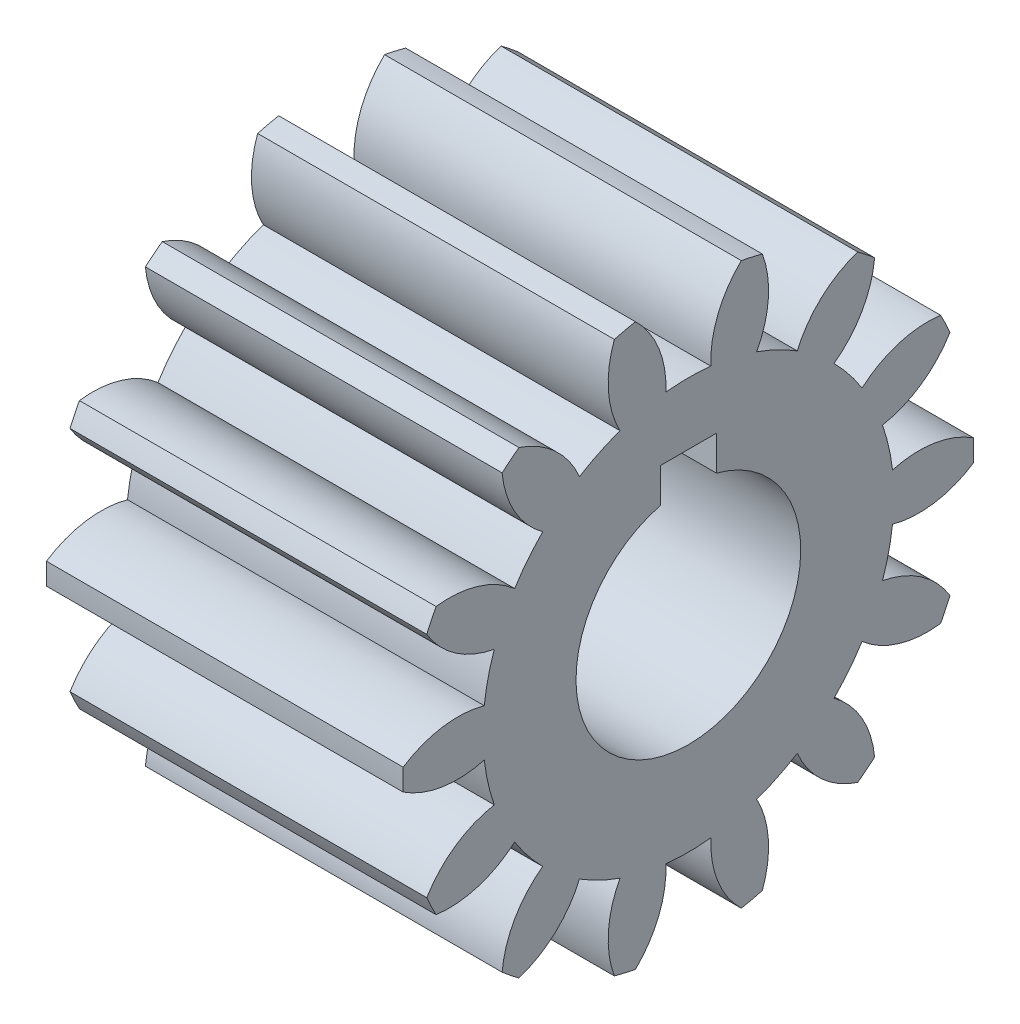
from build123d import *

# Parameters (mm, degrees)
BOSS_EXTRUDE1_DEPTH = 12.7


with BuildPart() as part:
    # Sketch1 → Boss-Extrude1 (new body)
    with BuildSketch(Plane(origin=(0, 0, 0), x_dir=(0, -1, 0), z_dir=(-1, 0, 0))):
        with BuildLine():
            ThreePointArc((-8.177440487, -6.029516323), (-7.943407862, -6.334656387), (-7.697995454, -6.630721377))
            ThreePointArc((-7.697995454, -6.630721377), (-6.273562142, -6.180849316), (-5.15957287, -5.185649317))
            ThreePointArc((-5.15957287, -5.185649317), (-4.560952599, -5.719253661), (-3.907521288, -6.184127135))
            ThreePointArc((-3.907521288, -6.184127135), (-4.629883612, -7.491639203), (-4.75151021, -8.98046495))
            ThreePointArc((-4.75151021, -8.98046495), (-4.408258789, -9.153843698), (-4.058692066, -9.314108584))
            ThreePointArc((-4.058692066, -9.314108584), (-2.970514168, -8.29074941), (-2.398645612, -6.910763363))
            ThreePointArc((-2.398645612, -6.910763363), (-1.627785136, -7.131792663), (-0.837362826, -7.267115971))
            ThreePointArc((-0.837362826, -7.267115971), (-0.920880567, -8.758564905), (-0.384485064, -10.152722356))
            ThreePointArc((-0.384485064, -10.152722356), (0, -10.16), (0.384485064, -10.152722356))
            ThreePointArc((0.384485064, -10.152722356), (0.920880567, -8.758564905), (0.837362826, -7.267115971))
            ThreePointArc((0.837362826, -7.267115971), (1.627785136, -7.131792663), (2.398645612, -6.910763363))
            ThreePointArc((2.398645612, -6.910763363), (2.970514168, -8.29074941), (4.058692066, -9.314108584))
            ThreePointArc((4.058692066, -9.314108584), (4.408258789, -9.153843698), (4.75151021, -8.98046495))
            ThreePointArc((4.75151021, -8.98046495), (4.629883612, -7.491639203), (3.907521288, -6.184127135))
            ThreePointArc((3.907521288, -6.184127135), (4.560952599, -5.719253661), (5.15957287, -5.185649317))
            ThreePointArc((5.15957287, -5.185649317), (6.273562142, -6.180849316), (7.697995454, -6.630721377))
            ThreePointArc((7.697995454, -6.630721377), (7.943407862, -6.334656387), (8.177440487, -6.029516323))
            ThreePointArc((8.177440487, -6.029516323), (7.421881426, -4.740902478), (6.203747236, -3.876296077))
            ThreePointArc((6.203747236, -3.876296077), (6.590767462, -3.173946328), (6.898583443, -2.433453825))
            ThreePointArc((6.898583443, -2.433453825), (8.334054192, -2.846756211), (9.812616434, -2.634038481))
            ThreePointArc((9.812616434, -2.634038481), (9.905267588, -2.260812689), (9.983728385, -1.884348041))
            ThreePointArc((9.983728385, -1.884348041), (8.7438846, -1.051171874), (7.271244959, -0.800717041))
            ThreePointArc((7.271244959, -0.800717041), (7.3152, 0), (7.271244959, 0.800717041))
            ThreePointArc((7.271244959, 0.800717041), (8.7438846, 1.051171874), (9.983728385, 1.884348041))
            ThreePointArc((9.983728385, 1.884348041), (9.905267588, 2.260812689), (9.812616434, 2.634038481))
            ThreePointArc((9.812616434, 2.634038481), (8.334054192, 2.846756211), (6.898583443, 2.433453825))
            ThreePointArc((6.898583443, 2.433453825), (6.590767462, 3.173946328), (6.203747236, 3.876296077))
            ThreePointArc((6.203747236, 3.876296077), (7.421881426, 4.740902478), (8.177440487, 6.029516323))
            ThreePointArc((8.177440487, 6.029516323), (7.943407862, 6.334656387), (7.697995454, 6.630721377))
            ThreePointArc((7.697995454, 6.630721377), (6.273562142, 6.180849316), (5.15957287, 5.185649317))
            ThreePointArc((5.15957287, 5.185649317), (4.560952599, 5.719253661), (3.907521288, 6.184127135))
            ThreePointArc((3.907521288, 6.184127135), (4.629883612, 7.491639203), (4.75151021, 8.98046495))
            ThreePointArc((4.75151021, 8.98046495), (4.408258789, 9.153843698), (4.058692066, 9.314108584))
            ThreePointArc((4.058692066, 9.314108584), (2.970514168, 8.29074941), (2.398645612, 6.910763363))
            ThreePointArc((2.398645612, 6.910763363), (1.627785136, 7.131792663), (0.837362826, 7.267115971))
            ThreePointArc((0.837362826, 7.267115971), (0.920880567, 8.758564905), (0.384485064, 10.152722356))
            ThreePointArc((0.384485064, 10.152722356), (0, 10.16), (-0.384485064, 10.152722356))
            ThreePointArc((-0.384485064, 10.152722356), (-0.920880567, 8.758564905), (-0.837362826, 7.267115971))
            ThreePointArc((-0.837362826, 7.267115971), (-1.627785136, 7.131792663), (-2.398645612, 6.910763363))
            ThreePointArc((-2.398645612, 6.910763363), (-2.970514168, 8.29074941), (-4.058692066, 9.314108584))
            ThreePointArc((-4.058692066, 9.314108584), (-4.408258789, 9.153843698), (-4.75151021, 8.98046495))
            ThreePointArc((-4.75151021, 8.98046495), (-4.629883612, 7.491639203), (-3.907521288, 6.184127135))
            ThreePointArc((-3.907521288, 6.184127135), (-4.560952599, 5.719253661), (-5.15957287, 5.185649317))
            ThreePointArc((-5.15957287, 5.185649317), (-6.273562142, 6.180849316), (-7.697995454, 6.630721377))
            ThreePointArc((-7.697995454, 6.630721377), (-7.943407862, 6.334656387), (-8.177440487, 6.029516323))
            ThreePointArc((-8.177440487, 6.029516323), (-7.421881426, 4.740902478), (-6.203747236, 3.876296077))
            ThreePointArc((-6.203747236, 3.876296077), (-6.590767462, 3.173946328), (-6.898583443, 2.433453825))
            ThreePointArc((-6.898583443, 2.433453825), (-8.334054192, 2.846756211), (-9.812616434, 2.634038481))
            ThreePointArc((-9.812616434, 2.634038481), (-9.905267588, 2.260812689), (-9.983728385, 1.884348041))
            ThreePointArc((-9.983728385, 1.884348041), (-8.7438846, 1.051171874), (-7.271244959, 0.800717041))
            ThreePointArc((-7.271244959, 0.800717041), (-7.3152, 0), (-7.271244959, -0.800717041))
            ThreePointArc((-7.271244959, -0.800717041), (-8.7438846, -1.051171874), (-9.983728385, -1.884348041))
            ThreePointArc((-9.983728385, -1.884348041), (-9.905267588, -2.260812689), (-9.812616434, -2.634038481))
            ThreePointArc((-9.812616434, -2.634038481), (-8.334054192, -2.846756211), (-6.898583443, -2.433453825))
            ThreePointArc((-6.898583443, -2.433453825), (-6.590767462, -3.173946328), (-6.203747236, -3.876296077))
            ThreePointArc((-6.203747236, -3.876296077), (-7.421881426, -4.740902478), (-8.177440487, -6.029516323))
        make_face()
        with BuildLine():
            Line((-5.1054, 1), (-3.872983346, 1))
            ThreePointArc((-3.872983346, 1), (4, 0), (-3.872983346, -1))
            Line((-3.872983346, -1), (-5.1054, -1))
            Line((-5.1054, -1), (-5.1054, 1))
        make_face(mode=Mode.SUBTRACT)
    extrude(amount=-BOSS_EXTRUDE1_DEPTH)


solid = part.part
